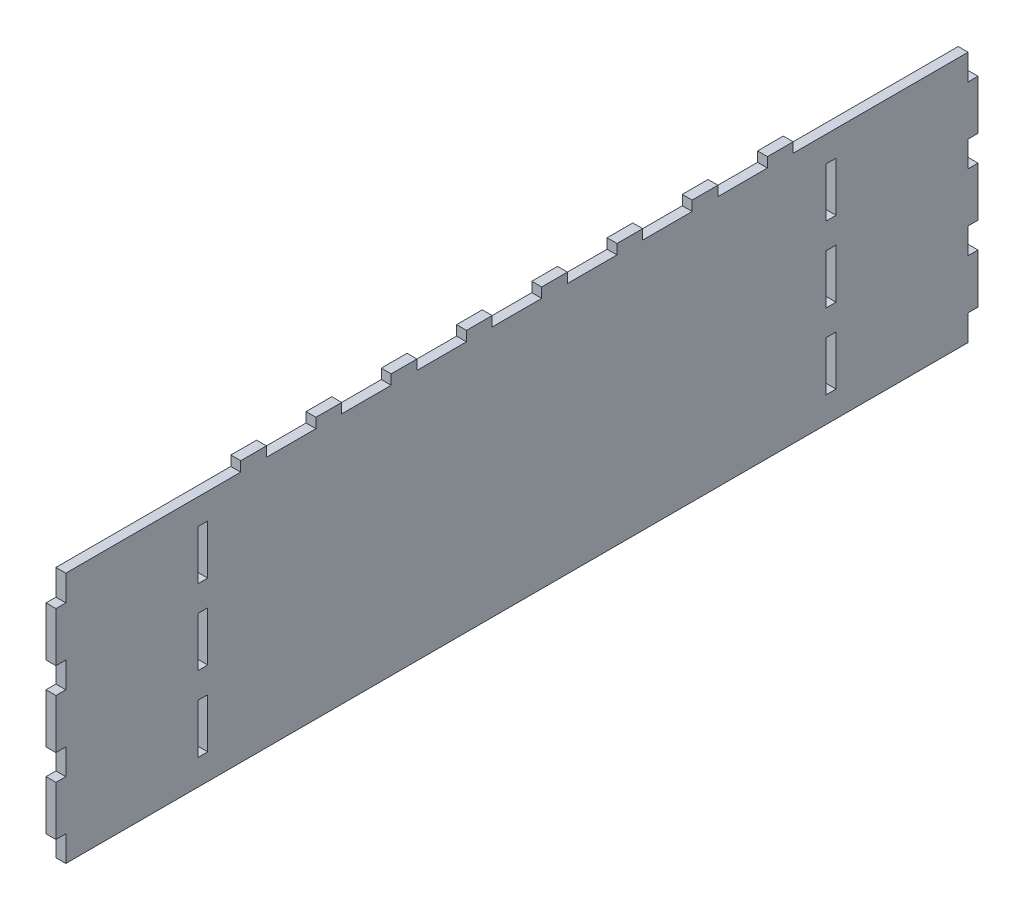
from build123d import *

# Parameters (mm, degrees)
SKETCH1_W               = 279.4
SKETCH1_H               = 76.2
BOSS_EXTRUDE1_DEPTH     = 3
SKETCH3_W               = 3
SKETCH3_H               = 7.8
CUT_EXTRUDE1_DEPTH      = 145.833352512
LPATTERN1_COUNT         = 4
LPATTERN1_PITCH         = 22.8
MIRROR1_COPY_1_SKETCH_W = 3
MIRROR1_COPY_1_SKETCH_H = 7.8
MIRROR1_COPY_1_DEPTH    = 145.833352512
MIRROR1_COPY_2_SKETCH_W = 3
MIRROR1_COPY_2_SKETCH_H = 7.8
MIRROR1_COPY_2_DEPTH    = 145.833352512
MIRROR1_COPY_3_SKETCH_W = 3
MIRROR1_COPY_3_SKETCH_H = 7.8
MIRROR1_COPY_3_DEPTH    = 145.833352512
SKETCH4_W               = 3
SKETCH4_H               = 15
CUT_EXTRUDE2_DEPTH      = 10
LPATTERN2_COUNT         = 3
LPATTERN2_PITCH         = 22.8
MIRROR2_COPY_1_SKETCH_W = 3
MIRROR2_COPY_1_SKETCH_H = 15
MIRROR2_COPY_1_DEPTH    = 10
MIRROR2_COPY_2_SKETCH_W = 3
MIRROR2_COPY_2_SKETCH_H = 15
MIRROR2_COPY_2_DEPTH    = 10
SKETCH5_W               = 3
SKETCH5_H               = 7.8
BOSS_EXTRUDE2_DEPTH     = 3
LPATTERN3_COUNT         = 8
LPATTERN3_PITCH         = 22.8


with BuildPart() as part:
    # Sketch1 → Boss-Extrude1 (new body)
    with BuildSketch(Plane(origin=(0, 0, 0), x_dir=(0, 0, -1), z_dir=(1, 0, 0))):
        Rectangle(SKETCH1_W, SKETCH1_H)
    extrude(amount=-BOSS_EXTRUDE1_DEPTH)

    # Sketch3 → Cut-Extrude1 (cut, through all)
    with BuildSketch(Plane.ZY.offset(3)):
        with Locations((-138.2, 34.2)):
            Rectangle(SKETCH3_W, SKETCH3_H)
    cut_extrude1 = extrude(amount=-CUT_EXTRUDE1_DEPTH, mode=Mode.SUBTRACT)

    # LPattern1: Cut-Extrude1 ×4
    with Locations(*[(0, -i * LPATTERN1_PITCH, 0) for i in range(1, LPATTERN1_COUNT)]):
        add(cut_extrude1, mode=Mode.SUBTRACT)

    # Mirror1: Cut-Extrude1 across plane
    add(cut_extrude1.mirror(Plane.XY), mode=Mode.SUBTRACT)

    # Mirror1 copy 1 sketch → Mirror1 copy 1 (cut, through all)
    with BuildSketch(Plane(origin=(-3, -22.8, 0), x_dir=(0, 0, -1), z_dir=(-1, 0, 0))):
        with Locations((-138.2, -34.2)):
            Rectangle(MIRROR1_COPY_1_SKETCH_W, MIRROR1_COPY_1_SKETCH_H)
    extrude(amount=-MIRROR1_COPY_1_DEPTH, mode=Mode.SUBTRACT)

    # Mirror1 copy 2 sketch → Mirror1 copy 2 (cut, through all)
    with BuildSketch(Plane(origin=(-3, -45.6, 0), x_dir=(0, 0, -1), z_dir=(-1, 0, 0))):
        with Locations((-138.2, -34.2)):
            Rectangle(MIRROR1_COPY_2_SKETCH_W, MIRROR1_COPY_2_SKETCH_H)
    extrude(amount=-MIRROR1_COPY_2_DEPTH, mode=Mode.SUBTRACT)

    # Mirror1 copy 3 sketch → Mirror1 copy 3 (cut, through all)
    with BuildSketch(Plane(origin=(-3, -68.4, 0), x_dir=(0, 0, -1), z_dir=(-1, 0, 0))):
        with Locations((-138.2, -34.2)):
            Rectangle(MIRROR1_COPY_3_SKETCH_W, MIRROR1_COPY_3_SKETCH_H)
    extrude(amount=-MIRROR1_COPY_3_DEPTH, mode=Mode.SUBTRACT)

    # Sketch4 → Cut-Extrude2 (cut)
    with BuildSketch(Plane(origin=(0, 0, 0), x_dir=(0, 0, -1), z_dir=(1, 0, 0))):
        with Locations((-95.2, 22.8)):
            Rectangle(SKETCH4_W, SKETCH4_H)
    cut_extrude2 = extrude(amount=-CUT_EXTRUDE2_DEPTH, mode=Mode.SUBTRACT)

    # LPattern2: Cut-Extrude2 ×3
    with Locations(*[(0, -i * LPATTERN2_PITCH, 0) for i in range(1, LPATTERN2_COUNT)]):
        add(cut_extrude2, mode=Mode.SUBTRACT)

    # Mirror2: Cut-Extrude2 across plane
    add(cut_extrude2.mirror(Plane.XY), mode=Mode.SUBTRACT)

    # Mirror2 copy 1 sketch → Mirror2 copy 1 (cut)
    with BuildSketch(Plane(origin=(0, -22.8, 0), x_dir=(0, 0, 1), z_dir=(1, 0, 0))):
        with Locations((-95.2, -22.8)):
            Rectangle(MIRROR2_COPY_1_SKETCH_W, MIRROR2_COPY_1_SKETCH_H)
    extrude(amount=-MIRROR2_COPY_1_DEPTH, mode=Mode.SUBTRACT)

    # Mirror2 copy 2 sketch → Mirror2 copy 2 (cut)
    with BuildSketch(Plane(origin=(0, -45.6, 0), x_dir=(0, 0, 1), z_dir=(1, 0, 0))):
        with Locations((-95.2, -22.8)):
            Rectangle(MIRROR2_COPY_2_SKETCH_W, MIRROR2_COPY_2_SKETCH_H)
    extrude(amount=-MIRROR2_COPY_2_DEPTH, mode=Mode.SUBTRACT)

    # Sketch5 → Boss-Extrude2 (add)
    with BuildSketch(Plane(origin=(0, 38.1, 0), x_dir=(1, 0, 0), z_dir=(0, 1, 0))):
        with Locations((-1.5, -79.8)):
            Rectangle(SKETCH5_W, SKETCH5_H)
    boss_extrude2 = extrude(amount=BOSS_EXTRUDE2_DEPTH)

    # LPattern3: Boss-Extrude2 ×8
    with Locations(*[(0, 0, -i * LPATTERN3_PITCH) for i in range(1, LPATTERN3_COUNT)]):
        add(boss_extrude2)


solid = part.part
